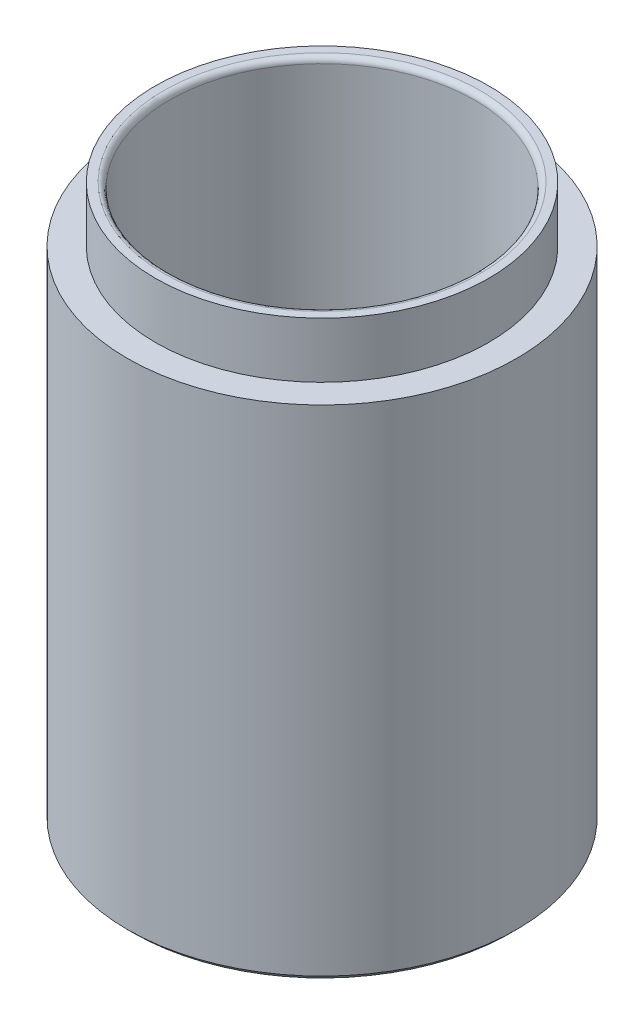
from build123d import *

# Parameters (mm, degrees)
SKETCH1_R           = 35
BOSS_EXTRUDE1_DEPTH = 100
SKETCH1_3_R         = 35
SKETCH1_3_R_2       = 30
CUT_EXTRUDE1_DEPTH  = 10
SKETCH1_4_R         = 27.5
CUT_EXTRUDE2_DEPTH  = 95
CHAMFER1_SIZE       = 1
FILLET1_R           = 1


with BuildPart() as part:
    # Sketch1 → Boss-Extrude1 (new body)
    with BuildSketch(Plane(origin=(0, 0, 0), x_dir=(1, 0, 0), z_dir=(0, 1, 0))):
        Circle(SKETCH1_R)
    extrude(amount=-BOSS_EXTRUDE1_DEPTH)

    # Sketch1<3> → Cut-Extrude1 (cut)
    with BuildSketch(Plane(origin=(0, 0, 0), x_dir=(1, 0, 0), z_dir=(0, 1, 0))):
        Circle(SKETCH1_3_R)
        Circle(SKETCH1_3_R_2, mode=Mode.SUBTRACT)
    extrude(amount=-CUT_EXTRUDE1_DEPTH, mode=Mode.SUBTRACT)

    # Sketch1<4> → Cut-Extrude2 (cut)
    with BuildSketch(Plane(origin=(0, 0, 0), x_dir=(1, 0, 0), z_dir=(0, 1, 0))):
        Circle(SKETCH1_4_R)
    extrude(amount=-CUT_EXTRUDE2_DEPTH, mode=Mode.SUBTRACT)

    # Chamfer1
    chamfer1_edges = [part.edges().sort_by_distance(p)[0] for p in [
        (-35, -100, 0),
    ]]
    chamfer(chamfer1_edges, length=CHAMFER1_SIZE)

    # Fillet1
    fillet1_edges = [part.edges().sort_by_distance(p)[0] for p in [
        (-27.5, 0, 0),
    ]]
    fillet(fillet1_edges, radius=FILLET1_R)


solid = part.part
